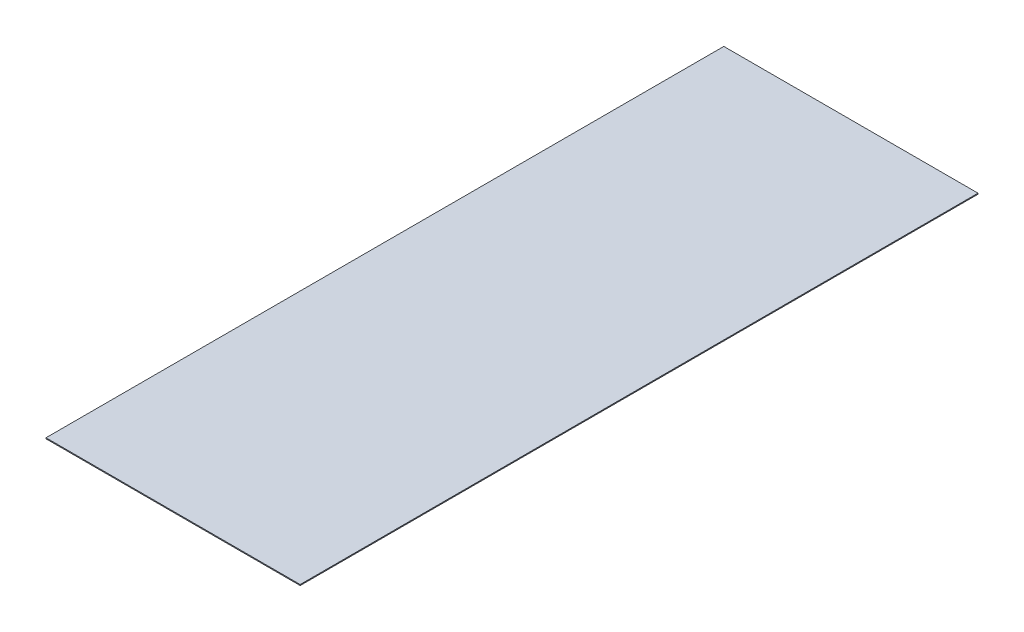
from build123d import *

# Parameters (mm, degrees)
CROQUIS1_W              = 914.4
CROQUIS1_H              = 2438.4
SALIENTE_EXTRUIR1_DEPTH = 3.4


with BuildPart() as part:
    # Croquis1 → Saliente-Extruir1 (new body)
    with BuildSketch(Plane(origin=(0, 0, 0), x_dir=(1, 0, 0), z_dir=(0, 1, 0))):
        Rectangle(CROQUIS1_W, CROQUIS1_H)
    extrude(amount=SALIENTE_EXTRUIR1_DEPTH)


solid = part.part
